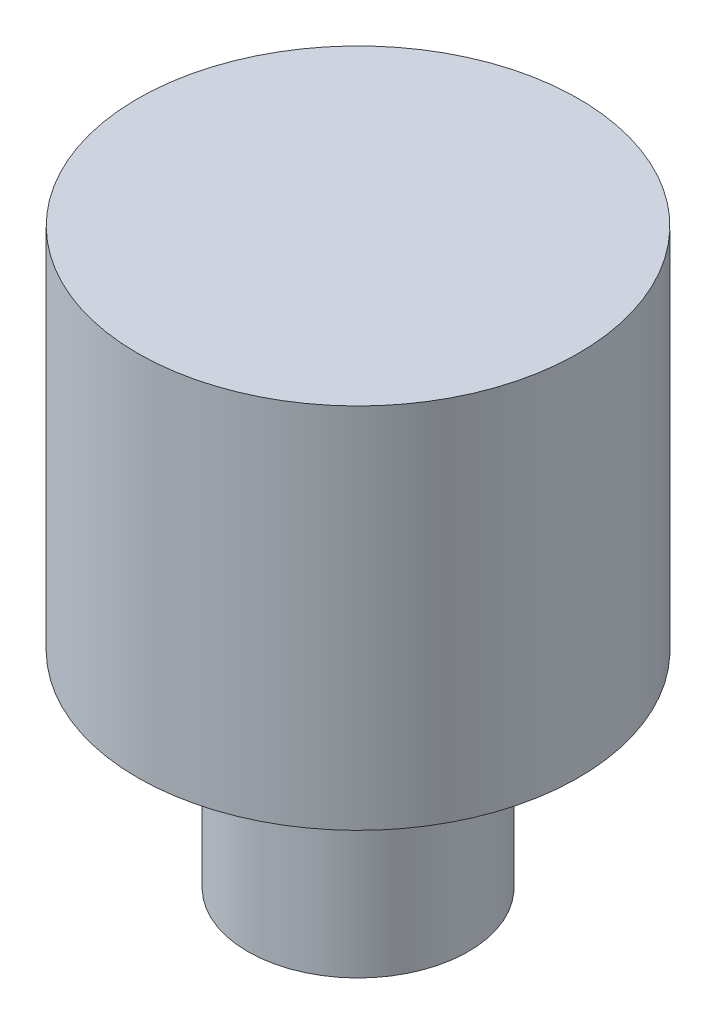
from build123d import *

# Parameters (mm, degrees)
SKETCH_1_R      = 1.5
EXTRUDE_1_DEPTH = 2.8
SKETCH_2_R      = 3
EXTRUDE_2_DEPTH = 5


with BuildPart() as part:
    # 草圖1 → 填料-伸長1 (new body)
    with BuildSketch(Plane(origin=(0, 0, 0), x_dir=(1, 0, 0), z_dir=(0, 1, 0))):
        with Locations(Location((0, 0, 0), (0, 0, 270))):
            Circle(SKETCH_1_R)
    extrude(amount=EXTRUDE_1_DEPTH)

    # 草圖2 → 填料-伸長2 (add)
    with BuildSketch(Plane(origin=(0, 2.8, 0), x_dir=(1, 0, 0), z_dir=(0, 1, 0))):
        with Locations(Location((0, 0, 0), (0, 0, 270))):
            Circle(SKETCH_2_R)
    extrude(amount=EXTRUDE_2_DEPTH)


solid = part.part
